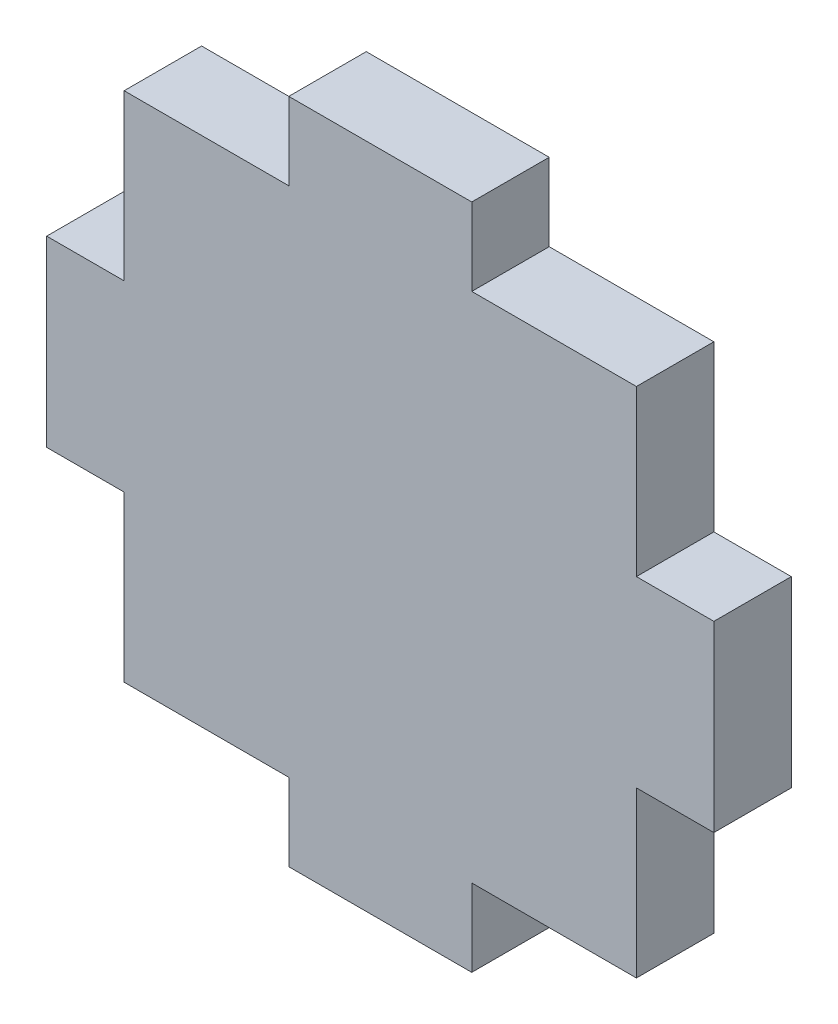
from build123d import *

# Parameters (mm, degrees)
SKETCH1_W           = 54.7
SKETCH1_H           = 54.7
BOSS_EXTRUDE1_DEPTH = 6.35
SKETCH2_W           = 6.35
SKETCH2_H           = 13.5
SKETCH2_H_2         = 6.35
SKETCH2_W_2         = 13.5
CUT_EXTRUDE1_DEPTH  = 40.196524081


with BuildPart() as part:
    # Sketch1 → Boss-Extrude1 (new body)
    with BuildSketch(Plane.XY):
        Rectangle(SKETCH1_W, SKETCH1_H)
    extrude(amount=BOSS_EXTRUDE1_DEPTH)

    # Sketch2 → Cut-Extrude1 (cut, through all)
    with BuildSketch(Plane.XY.offset(6.35)):
        with Locations((-24.175, 14.25)):
            Rectangle(SKETCH2_W, SKETCH2_H)
        with Locations((-24.175, 24.175)):
            Rectangle(SKETCH2_W, SKETCH2_H_2)
        with Locations((-14.25, 24.175)):
            Rectangle(SKETCH2_W_2, SKETCH2_H_2)
        with Locations((14.25, 24.175)):
            Rectangle(SKETCH2_W_2, SKETCH2_H_2)
        with Locations((24.175, 24.175)):
            Rectangle(SKETCH2_W, SKETCH2_H_2)
        with Locations((24.175, 14.25)):
            Rectangle(SKETCH2_W, SKETCH2_H)
        with Locations((24.175, -14.25)):
            Rectangle(SKETCH2_W, SKETCH2_H)
        with Locations((24.175, -24.175)):
            Rectangle(SKETCH2_W, SKETCH2_H_2)
        with Locations((14.25, -24.175)):
            Rectangle(SKETCH2_W_2, SKETCH2_H_2)
        with Locations((-14.25, -24.175)):
            Rectangle(SKETCH2_W_2, SKETCH2_H_2)
        with Locations((-24.175, -24.175)):
            Rectangle(SKETCH2_W, SKETCH2_H_2)
        with Locations((-24.175, -14.25)):
            Rectangle(SKETCH2_W, SKETCH2_H)
    extrude(amount=-CUT_EXTRUDE1_DEPTH, mode=Mode.SUBTRACT)


solid = part.part
